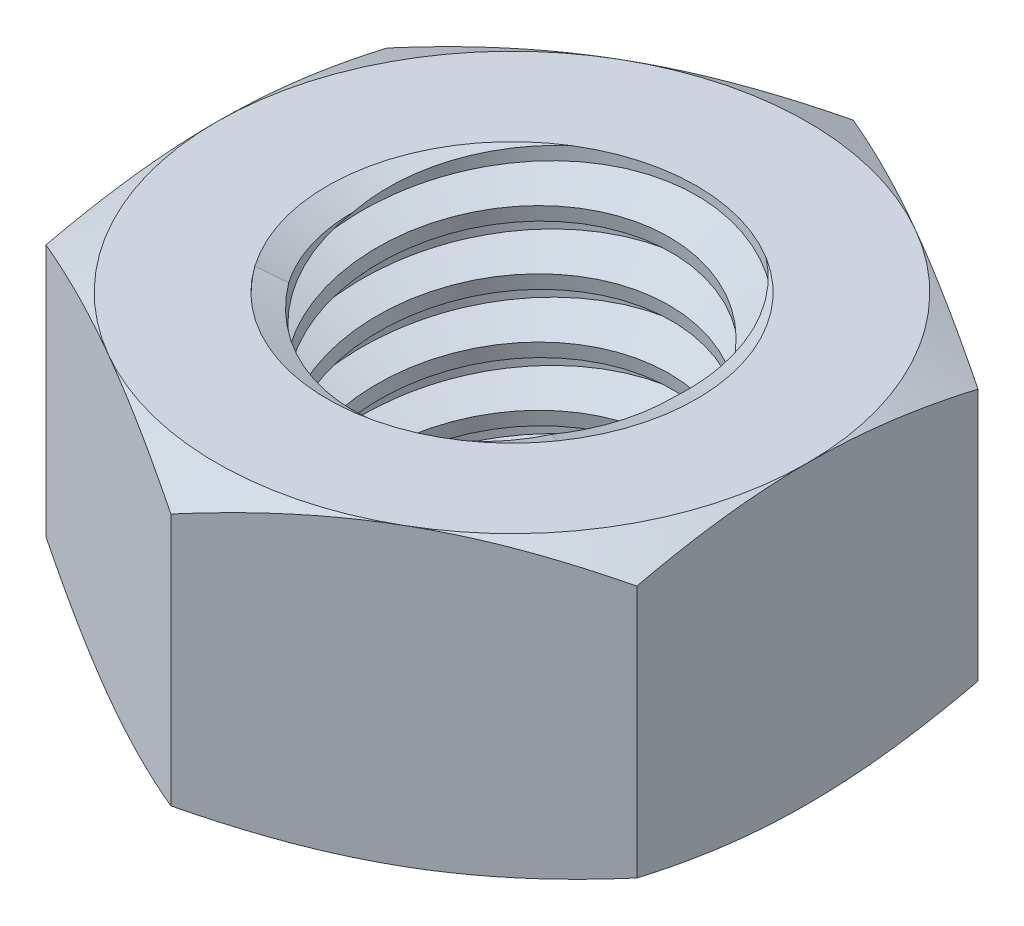
from build123d import *

# Parameters (mm, degrees)
EXTRUDE1_DEPTH      = 2
SKETCH2_W           = 2.5
SKETCH2_H           = 4
LPATTERN1_COUNT     = 5
LPATTERN1_PITCH     = 0.8
LPATTERN1_COL_COUNT = 2
LPATTERN1_COL_PITCH = 0.8


with BuildPart() as part:
    # Sketch1 → Extrude1 (new, symmetric)
    with BuildSketch(Plane(origin=(0, 0, 0), x_dir=(1, 0, 0), z_dir=(0, 1, 0))):
        Polygon((0, 4.618802154), (-4, 2.309401077), (-4, -2.309401077), (0, -4.618802154), (4, -2.309401077), (4, 2.309401077), align=None)
    extrude(amount=EXTRUDE1_DEPTH, both=True)

    # Sketch4 → Cut-Revolve2 (revolve, cut)
    with BuildSketch(Plane(origin=(0, 0, 0), x_dir=(0, 0, -1), z_dir=(1, 0, 0))):
        Polygon((0, 2), (2.5, 2), (2.127722339, 1.826404076), (2.127722339, -1.826404076), (2.5, -2), (0, -2), align=None)
    revolve(axis=Axis((0, 2, 0), (0, 1, 0)), mode=Mode.SUBTRACT)


with BuildPart() as body_2:
    # Sketch2 → Revolve1 (revolve)
    with BuildSketch(Plane(origin=(0, 0, 0), x_dir=(0, 0, -1), z_dir=(1, 0, 0))):
        with Locations((1.25, 0)):
            Rectangle(SKETCH2_W, SKETCH2_H)
    revolve(axis=Axis((0, -4.5, 0), (0, 1, 0)))

    # Sketch3 → Cut-Revolve1 (revolve, cut)
    with BuildSketch(Plane(origin=(0, 0, 0), x_dir=(0, 0, -1), z_dir=(1, 0, 0)), mode=Mode.PRIVATE) as cut_revolve1_sk:
        Polygon((2.51579905, 1.901255937), (2.626392401, 1.210047494), (2.15932044, 1.388495759), (2.127722339, 1.585983885), align=None)
    cut_revolve1 = revolve(cut_revolve1_sk.sketch.rotate(Axis((0, 2, 0.136915776), (0, -0.9874406319167053, -0.15799050110667312)), 180), axis=Axis((0, 2, 0.136915776), (0, -0.9874406319167053, -0.15799050110667312)), mode=Mode.SUBTRACT)

    # LPattern1: Cut-Revolve1 ×5
    with Locations(*[(0, -i * LPATTERN1_PITCH, 0) for i in range(1, LPATTERN1_COUNT)]):
        add(cut_revolve1, mode=Mode.SUBTRACT)

    # LPattern1 col: Cut-Revolve1 ×2
    with Locations(*[(0, i * LPATTERN1_COL_PITCH, 0) for i in range(1, LPATTERN1_COL_COUNT)]):
        add(cut_revolve1, mode=Mode.SUBTRACT)


with BuildPart() as part_1:
    add(part.part)

    # Combine1: cut body 2
    add(body_2.part, mode=Mode.SUBTRACT)

    # Sketch5 → Cut-Revolve3 (revolve, cut)
    with BuildSketch(Plane(origin=(0, 0, 0), x_dir=(0, 0, -1), z_dir=(1, 0, 0)), mode=Mode.PRIVATE) as cut_revolve3_sk:
        Polygon((0, -2), (4, -2), (4.618802154, -1.711447817), (4.618802154, 1.711447817), (4, 2), (0, 2), (0, 3.27), (5.888802154, 3.27), (5.888802154, -3.27), (0, -3.27), align=None)
    revolve(cut_revolve3_sk.sketch.rotate(Axis((0, -2, 0), (0, 1, 0)), 55.091745584), axis=Axis((0, -2, 0), (0, 1, 0)), mode=Mode.SUBTRACT)


solid = part_1.part
